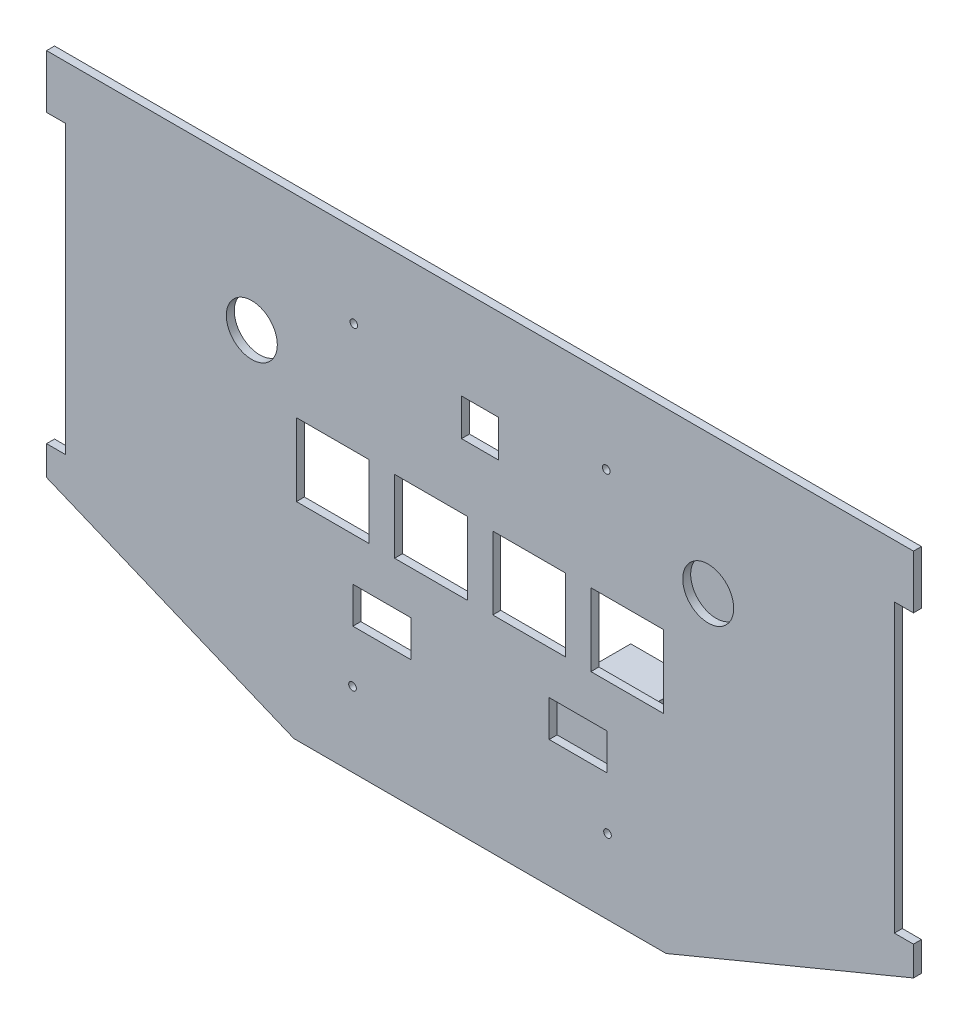
from build123d import *

# Parameters (mm, degrees)
SKETCH1_R           = 20
SKETCH1_R_2         = 3
SKETCH1_W           = 57
SKETCH1_H           = 57
SKETCH1_W_2         = 45.5
SKETCH1_H_2         = 28.5
SKETCH1_W_3         = 29
SKETCH1_H_3         = 29
BOSS_EXTRUDE1_DEPTH = 6.25
SKETCH2_W           = 70.5
SKETCH2_H           = 42.5
SKETCH2_W_2         = 50
SKETCH2_H_2         = 33
BOSS_EXTRUDE2_DEPTH = 60


with BuildPart() as part:
    # Sketch1 → Boss-Extrude1 (new body)
    with BuildSketch(Plane.XY):
        Polygon((-340, 0), (340, 0), (340, -42), (325, -42), (325, -267), (340, -267), (340, -290), (145.985298173, -370.363520797), (-145.985298173, -370.363520797), (-340, -290), (-340, -267), (-325, -267), (-325, -42), (-340, -42), align=None)
        with Locations((-179, -109.363520797)):
            Circle(SKETCH1_R, mode=Mode.SUBTRACT)
        with Locations((179, -109.363520797)):
            Circle(SKETCH1_R, mode=Mode.SUBTRACT)
        with Locations((-99, -65)):
            Circle(SKETCH1_R_2, mode=Mode.SUBTRACT)
        with Locations((-100, -311.863520797)):
            Circle(SKETCH1_R_2, mode=Mode.SUBTRACT)
        with Locations((99, -65)):
            Circle(SKETCH1_R_2, mode=Mode.SUBTRACT)
        with Locations((100, -311.863520797)):
            Circle(SKETCH1_R_2, mode=Mode.SUBTRACT)
        with Locations((-115.5, -179.863520797)):
            Rectangle(SKETCH1_W, SKETCH1_H, mode=Mode.SUBTRACT)
        with Locations((-38.5, -179.863520797)):
            Rectangle(SKETCH1_W, SKETCH1_H, mode=Mode.SUBTRACT)
        with Locations((38.5, -179.863520797)):
            Rectangle(SKETCH1_W, SKETCH1_H, mode=Mode.SUBTRACT)
        with Locations((115.5, -179.863520797)):
            Rectangle(SKETCH1_W, SKETCH1_H, mode=Mode.SUBTRACT)
        with Locations((-77, -256.613520797)):
            Rectangle(SKETCH1_W_2, SKETCH1_H_2, mode=Mode.SUBTRACT)
        with Locations((77, -256.613520797)):
            Rectangle(SKETCH1_W_2, SKETCH1_H_2, mode=Mode.SUBTRACT)
        with Locations((0, -86.363520797)):
            Rectangle(SKETCH1_W_3, SKETCH1_H_3, mode=Mode.SUBTRACT)
    extrude(amount=BOSS_EXTRUDE1_DEPTH)

    # Sketch2 → Boss-Extrude2 (add)
    with BuildSketch(Plane.XY):
        with Locations((179, -109.363520797)):
            Rectangle(SKETCH2_W, SKETCH2_H)
        with Locations((77, -256.613520797)):
            Rectangle(SKETCH2_W_2, SKETCH2_H_2)
    extrude(amount=-BOSS_EXTRUDE2_DEPTH)


solid = part.part
